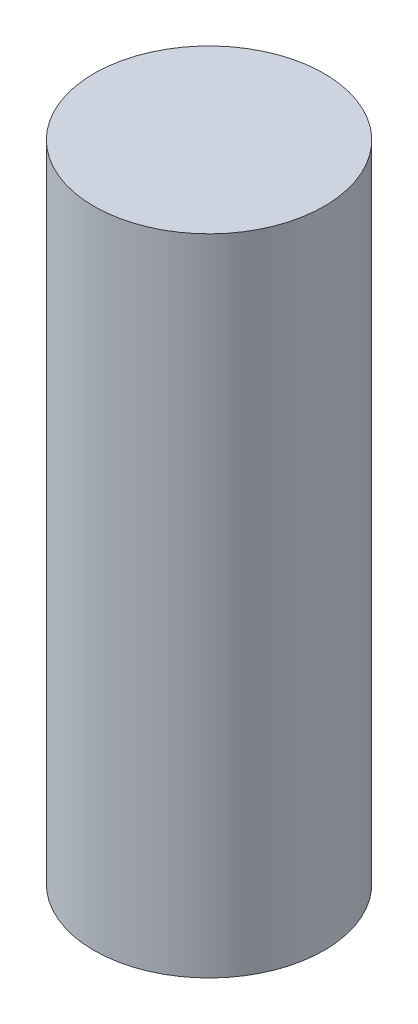
from build123d import *

# Parameters (mm, degrees)
DROGUE_CHUTE_PROFILE_R  = 31.75
DROGUE_CHUTE_BODY_DEPTH = 177.8


with BuildPart() as part:
    # Drogue Chute Profile → Drogue Chute Body (new body)
    with BuildSketch(Plane(origin=(0, 0, 0), x_dir=(1, 0, 0), z_dir=(0, 1, 0))):
        with Locations(Location((0, 0, 0), (0, 0, 270))):
            Circle(DROGUE_CHUTE_PROFILE_R)
    extrude(amount=DROGUE_CHUTE_BODY_DEPTH)


solid = part.part
